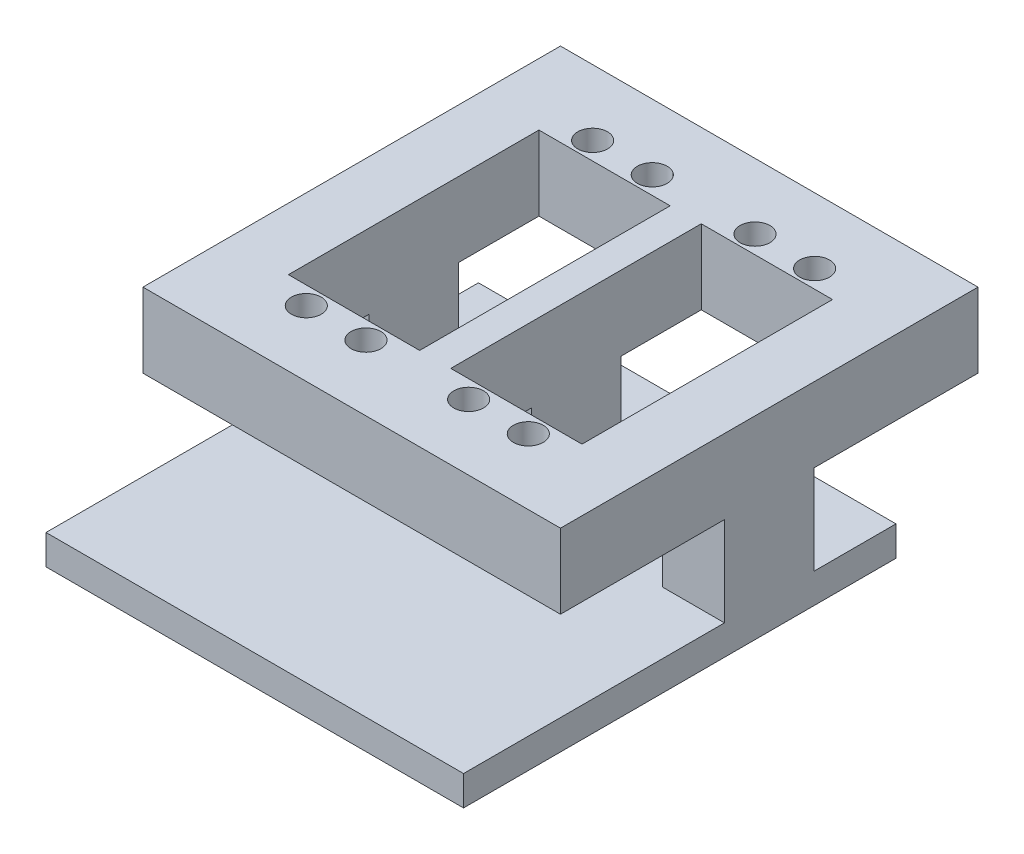
from build123d import *

# Parameters (mm, degrees)
SKETCH1_W           = 70
SKETCH1_H           = 70
SKETCH1_R           = 2.5
SKETCH1_W_2         = 22
SKETCH1_H_2         = 42
BOSS_EXTRUDE1_DEPTH = 12.5
SKETCH3_W           = 10.391499035
SKETCH3_H           = 15
SKETCH3_W_2         = 5.21700193
BOSS_EXTRUDE2_DEPTH = 15
SKETCH8_W           = 70
SKETCH8_H           = 42.5
BOSS_EXTRUDE5_DEPTH = 5
SKETCH12_W          = 70
SKETCH12_H          = 5
BOSS_EXTRUDE6_DEPTH = 30


with BuildPart() as part:
    # Sketch1 → Boss-Extrude1 (new body)
    with BuildSketch(Plane(origin=(0, 0, 0), x_dir=(1, 0, 0), z_dir=(0, 1, 0))):
        Rectangle(SKETCH1_W, SKETCH1_H)
        with Locations(Location((-18.608500965, 24, 0), (0, 0, 270))):
            Circle(SKETCH1_R, mode=Mode.SUBTRACT)
        with Locations(Location((-8.608500965, 24, 0), (0, 0, 270))):
            Circle(SKETCH1_R, mode=Mode.SUBTRACT)
        with Locations(Location((-8.608500965, -24, 0), (0, 0, 90))):
            Circle(SKETCH1_R, mode=Mode.SUBTRACT)
        with Locations(Location((-18.608500965, -24, 0), (0, 0, 90))):
            Circle(SKETCH1_R, mode=Mode.SUBTRACT)
        with Locations(Location((8.608500965, -24, 0), (0, 0, 270))):
            Circle(SKETCH1_R, mode=Mode.SUBTRACT)
        with Locations(Location((18.608500965, -24, 0), (0, 0, 270))):
            Circle(SKETCH1_R, mode=Mode.SUBTRACT)
        with Locations(Location((8.608500965, 24, 0), (0, 0, 90))):
            Circle(SKETCH1_R, mode=Mode.SUBTRACT)
        with Locations(Location((18.608500965, 24, 0), (0, 0, 90))):
            Circle(SKETCH1_R, mode=Mode.SUBTRACT)
        with Locations((-13.608500965, 0)):
            Rectangle(SKETCH1_W_2, SKETCH1_H_2, mode=Mode.SUBTRACT)
        with Locations((13.608500965, 0)):
            Rectangle(SKETCH1_W_2, SKETCH1_H_2, mode=Mode.SUBTRACT)
    extrude(amount=BOSS_EXTRUDE1_DEPTH)

    # Sketch3 → Boss-Extrude2 (add)
    with BuildSketch(Plane.XZ):
        with Locations((-29.804250483, 0)):
            Rectangle(SKETCH3_W, SKETCH3_H)
        Rectangle(SKETCH3_W_2, SKETCH3_H)
        with Locations((29.804250483, 0)):
            Rectangle(SKETCH3_W, SKETCH3_H)
    extrude(amount=BOSS_EXTRUDE2_DEPTH)

    # Sketch8 → Boss-Extrude5 (add)
    with BuildSketch(Plane.XZ.offset(15)):
        Rectangle(SKETCH8_W, SKETCH8_H)
    extrude(amount=BOSS_EXTRUDE5_DEPTH)

    # Sketch12 → Boss-Extrude6 (add)
    with BuildSketch(Plane.XY.offset(21.25)):
        with Locations((0, -17.5)):
            Rectangle(SKETCH12_W, SKETCH12_H)
    extrude(amount=BOSS_EXTRUDE6_DEPTH)


solid = part.part
